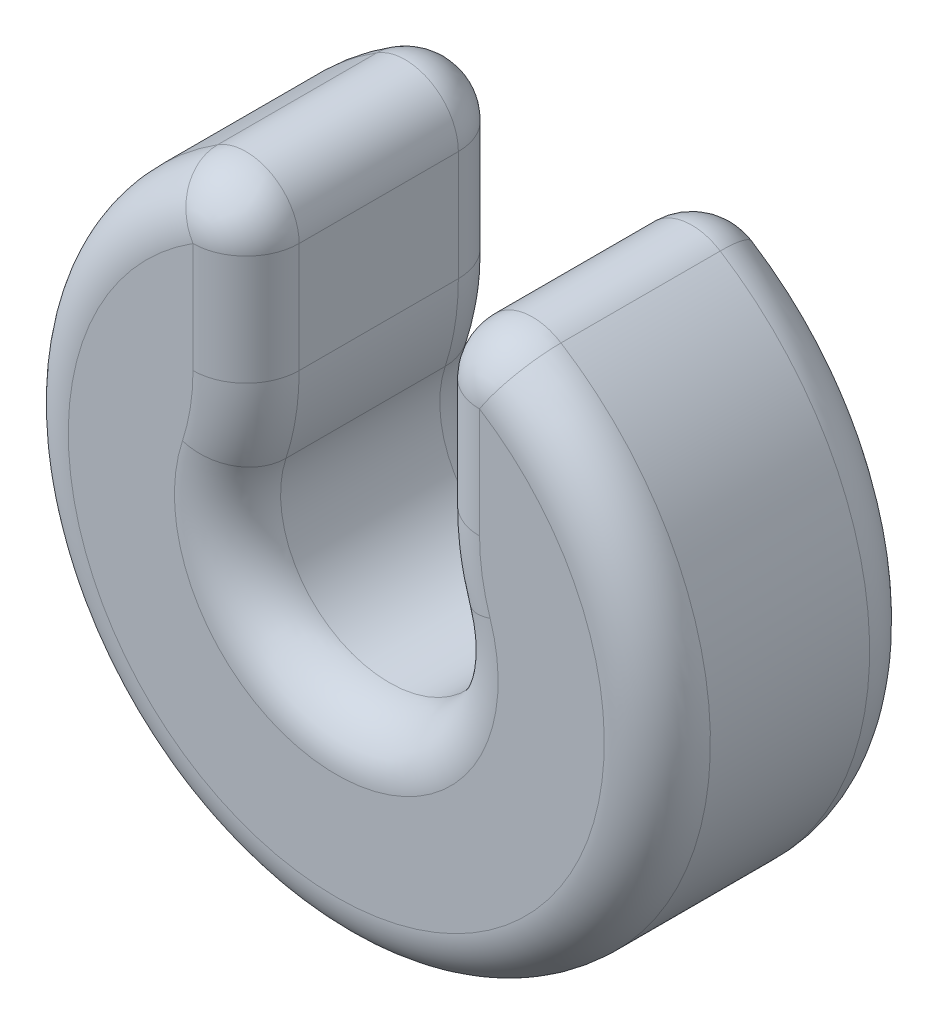
from build123d import *

# Parameters (mm, degrees)
BOSS_EXTRUDE1_DEPTH = 5
FILLET1_R           = 5
FILLET3_R           = 1
FILLET4_R           = 1


with BuildPart() as part:
    # Sketch1 → Boss-Extrude1 (new body)
    with BuildSketch(Plane.XY):
        with BuildLine():
            Line((-1.7, 5.806246636), (-1.7, 1.145643924))
            ThreePointArc((-1.7, 1.145643924), (0, -2.05), (1.7, 1.145643924))
            Line((1.7, 1.145643924), (1.7, 5.806246636))
            ThreePointArc((1.7, 5.806246636), (0, -6.05), (-1.7, 5.806246636))
        make_face()
    extrude(amount=BOSS_EXTRUDE1_DEPTH)

    # Fillet1
    fillet1_edges = [part.edges().sort_by_distance(p)[0] for p in [
        (-1.7, 1.145643924, 2.5),
        (1.7, 1.145643924, 2.5),
    ]]
    fillet(fillet1_edges, radius=FILLET1_R)

    # Fillet3
    fillet3_edges = [part.edges().sort_by_distance(p)[0] for p in [
        (-1.7, 5.806246636, 2.5),
        (1.7, 5.806246636, 2.5),
    ]]
    fillet(fillet3_edges, radius=FILLET3_R)

    # Fillet4
    fillet4_edges = [part.edges().sort_by_distance(p)[0] for p in [
        (0, -2.05, 0),
        (0, -2.05, 5),
        (-1.7, 3.230675835, 0),
        (-1.762446697, 1.405980108, 0),
        (1.762446697, 1.405980108, 0),
        (-1.7, 3.230675835, 5),
        (-1.762446697, 1.405980108, 5),
        (1.762446697, 1.405980108, 5),
        (1.7, 3.230675835, 0),
        (1.7, 3.230675835, 5),
        (0, -6.05, 0),
        (-2.217637826, 5.143582452, 0),
        (2.217637826, 5.143582452, 0),
        (0, -6.05, 5),
        (-2.217637826, 5.143582452, 5),
        (2.217637826, 5.143582452, 5),
    ]]
    fillet(fillet4_edges, radius=FILLET4_R)


solid = part.part
